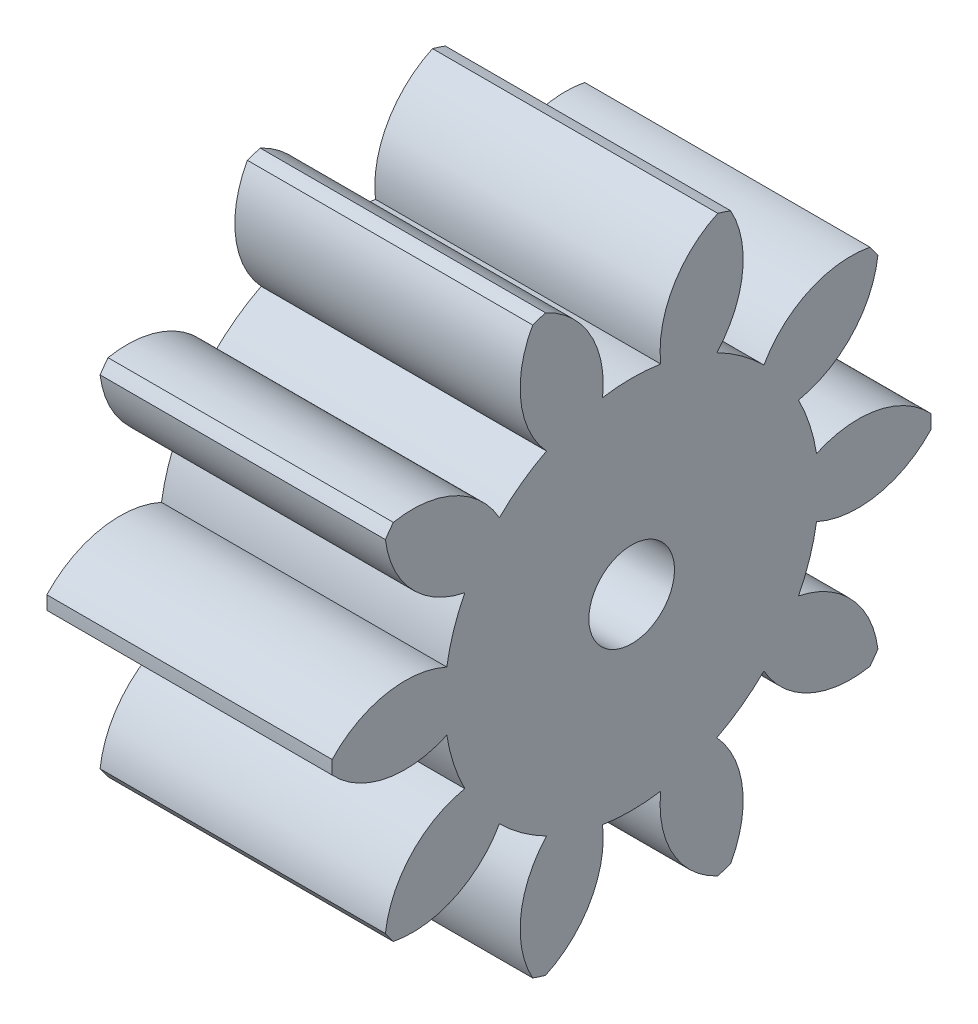
from build123d import *

# Parameters (mm, degrees)
BASPROSKE_W     = 10
BASPROSKE_H     = 10.5
TOOTHCUT_DEPTH  = 18.90251379
TEETHCUTS_COUNT = 10
TEETHCUTS_ANGLE = 324
BORSKE_R        = 1.5
BORE_DEPTH      = 50.0000508


with BuildPart() as part:
    # BasProSke → Base-Revolve (revolve)
    with BuildSketch(Plane(origin=(0, 0, 0), x_dir=(1, 0, 0), z_dir=(0, 1, 0)), mode=Mode.PRIVATE) as base_revolve_sk:
        with Locations((5, 5.25)):
            Rectangle(BASPROSKE_W, BASPROSKE_H)
    revolve(base_revolve_sk.sketch.rotate(Axis((-10, 0, 0), (1, 0, 0)), 180), axis=Axis((-10, 0, 0), (1, 0, 0)))

    # TooCutSke → ToothCut (cut, through all)
    with BuildSketch(Plane(origin=(0, 0, 0), x_dir=(0, 0, -1), z_dir=(1, 0, 0))):
        with BuildLine():
            ThreePointArc((1.019600066, 6.481797432), (0, 6.5615), (-1.019600066, 6.481797432))
            ThreePointArc((-1.019600066, 6.481797432), (-1.451036104, 8.608938557), (-3.053606956, 10.072712133))
            ThreePointArc((-3.053606956, 10.072712133), (0, 10.5254), (3.053606956, 10.072712133))
            ThreePointArc((3.053606956, 10.072712133), (1.451036104, 8.608938557), (1.019600066, 6.481797432))
        make_face()
    toothcut = extrude(amount=TOOTHCUT_DEPTH, mode=Mode.SUBTRACT)

    # TeethCuts: ToothCut ×10 about axis
    teethcuts_axis = Axis((-10, 0, 0), (1, 0, 0))
    for i in range(1, TEETHCUTS_COUNT):
        add(toothcut.rotate(teethcuts_axis, i * TEETHCUTS_ANGLE / (TEETHCUTS_COUNT - 1)), mode=Mode.SUBTRACT)

    # BorSke → Bore (cut, symmetric)
    with BuildSketch(Plane(origin=(0, 0, 0), x_dir=(0, 0, -1), z_dir=(1, 0, 0))):
        with Locations(Location((0, 0, 0), (0, 0, 180))):
            Circle(BORSKE_R)
    extrude(amount=BORE_DEPTH, both=True, mode=Mode.SUBTRACT)


solid = part.part
